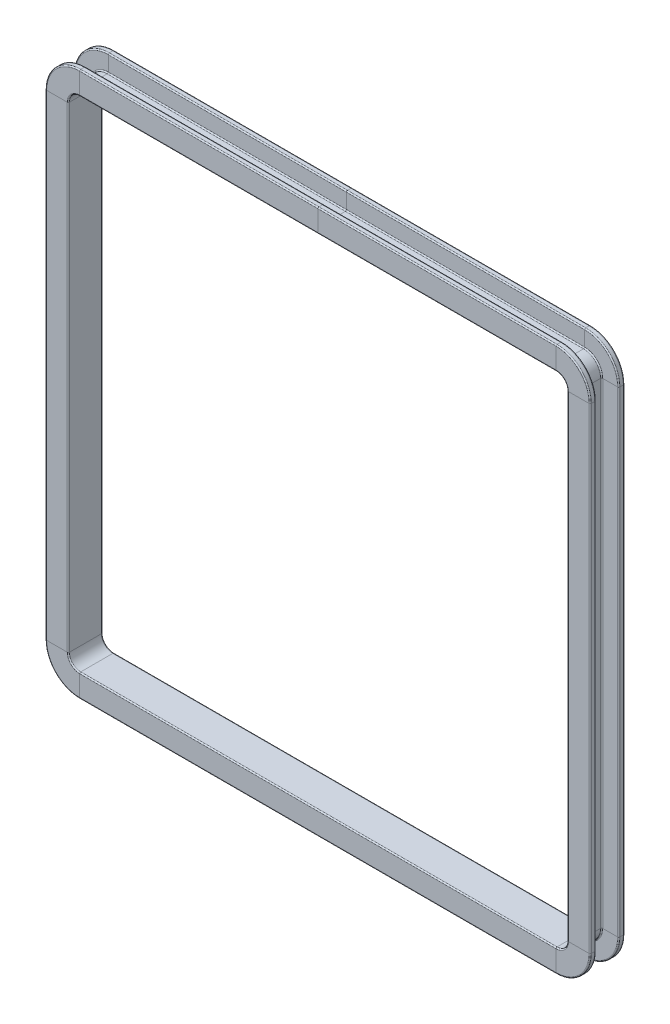
from build123d import *


with BuildPart() as part:
    # Sweep1: sweep along a path in Sketch2
    with BuildLine(Plane.XY) as sweep1_path:
        Line((945.75, 990.75), (-945.75, 990.75))
        ThreePointArc((-945.75, 990.75), (-977.569805153, 977.569805153), (-990.75, 945.75))
        Line((-990.75, 945.75), (-990.75, -945.75))
        ThreePointArc((-990.75, -945.75), (-977.569805153, -977.569805153), (-945.75, -990.75))
        Line((-945.75, -990.75), (945.75, -990.75))
        ThreePointArc((945.75, -990.75), (977.569805153, -977.569805153), (990.75, -945.75))
        Line((990.75, -945.75), (990.75, 945.75))
        ThreePointArc((990.75, 945.75), (977.569805153, 977.569805153), (945.75, 990.75))
    # Sketch3 → Sweep1 (sweep)
    with BuildSketch(Plane(origin=(0, 0, 0), x_dir=(0, 0, -1), z_dir=(1, 0, 0))):
        with BuildLine():
            Line((-63.525, 990.75), (63.525, 990.75))
            ThreePointArc((63.525, 990.75), (66.73349702, 992.07900298), (68.0625, 995.2875))
            Line((68.0625, 995.2875), (68.0625, 1076.9625))
            ThreePointArc((68.0625, 1076.9625), (66.73349702, 1080.17099702), (63.525, 1081.5))
            Line((63.525, 1081.5), (49.9125, 1081.5))
            ThreePointArc((49.9125, 1081.5), (46.70400298, 1080.17099702), (45.375, 1076.9625))
            Line((45.375, 1076.9625), (45.375, 1017.975))
            ThreePointArc((45.375, 1017.975), (44.04599702, 1014.76650298), (40.8375, 1013.4375))
            Line((40.8375, 1013.4375), (-40.8375, 1013.4375))
            ThreePointArc((-40.8375, 1013.4375), (-44.04599702, 1014.76650298), (-45.375, 1017.975))
            Line((-45.375, 1017.975), (-45.375, 1076.9625))
            ThreePointArc((-45.375, 1076.9625), (-46.70400298, 1080.17099702), (-49.9125, 1081.5))
            Line((-49.9125, 1081.5), (-63.525, 1081.5))
            ThreePointArc((-63.525, 1081.5), (-66.73349702, 1080.17099702), (-68.0625, 1076.9625))
            Line((-68.0625, 1076.9625), (-68.0625, 995.2875))
            ThreePointArc((-68.0625, 995.2875), (-66.73349702, 992.07900298), (-63.525, 990.75))
        make_face()
    sweep(path=sweep1_path.line)


solid = part.part
